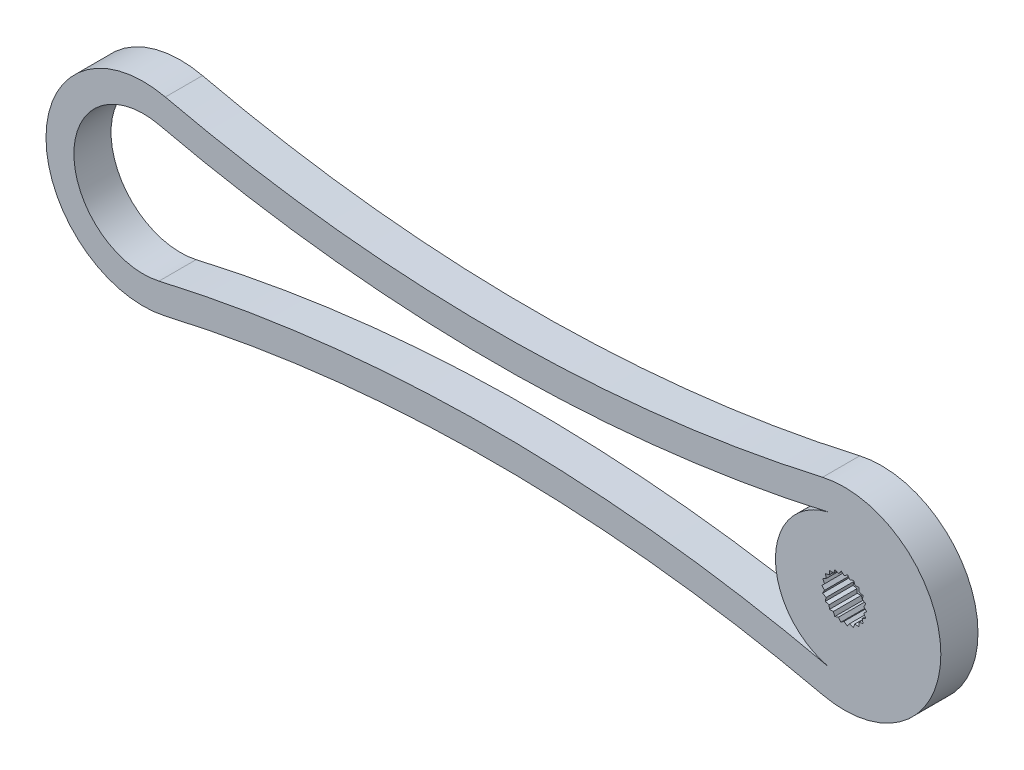
from build123d import *

# Parameters (mm, degrees)
SKIZZE1_R                       = 1
AUFSATZ_LINEAR_AUSTRAGEN1_DEPTH = 4
SCHNITT_LINEAR_AUSTRAGEN1_DEPTH = 6
SCHNITT_LINEAR_AUSTRAGEN2_DEPTH = 3


with BuildPart() as part:
    # Skizze1 → Aufsatz-Linear austragen1 (new body)
    with BuildSketch(Plane.XY):
        with BuildLine():
            ThreePointArc((-73.08156136, 10.209205546), (-85.925298124, 0), (-73.08156136, -10.209205546))
            ThreePointArc((-73.08156136, -10.209205546), (-37.708269243, -6.148967962), (-2.327018144, -10.139255556))
            ThreePointArc((-2.327018144, -10.139255556), (10.402860985, 0), (-2.327018144, 10.139255556))
            ThreePointArc((-2.327018144, 10.139255556), (-37.708269243, 6.148967962), (-73.08156136, 10.209205546))
        make_face()
        Circle(SKIZZE1_R, mode=Mode.SUBTRACT)
    extrude(amount=AUFSATZ_LINEAR_AUSTRAGEN1_DEPTH)

    # Skizze2 → Schnitt-Linear austragen1 (cut)
    with BuildSketch(Plane.XY.offset(4)):
        with BuildLine():
            ThreePointArc((-1.655947518, 7.215274671), (-7.402860985, 0), (-1.655947518, -7.215274671))
            ThreePointArc((-1.655947518, -7.215274671), (-37.711235128, -3.148969428), (-73.758412133, -7.286557255))
            ThreePointArc((-73.758412133, -7.286557255), (-82.925298124, 0), (-73.758412133, 7.286557255))
            ThreePointArc((-73.758412133, 7.286557255), (-37.711235128, 3.148969428), (-1.655947518, 7.215274671))
        make_face()
    extrude(amount=-SCHNITT_LINEAR_AUSTRAGEN1_DEPTH, mode=Mode.SUBTRACT)

    # Skizze6 → Schnitt-Linear austragen2 (cut)
    with BuildSketch(Plane.XY.offset(4)):
        Polygon((1.165582934, 1.788027089), (1.018080563, 2.19148446), (0.614623192, 2.043982089), (0.359428626, 2.389540381), (0.013870334, 2.134345816), (-0.32834208, 2.394009952), (-0.588006216, 2.051797538), (-0.989512463, 2.204531074), (-1.142245999, 1.803024827), (-1.570518432, 1.836454199), (-1.603947805, 1.408181766), (-2.024290337, 1.319598727), (-1.935707298, 0.899256194), (-2.314066279, 0.695837214), (-2.110647298, 0.317478234), (-2.416370332, 0.015703108), (-2.114595207, -0.290019926), (-2.322914432, -0.66570317), (-1.947231188, -0.874022395), (-2.04126982, -1.293178136), (-1.622114079, -1.387216768), (-1.594253667, -1.815887501), (-1.165582934, -1.788027089), (-1.018080563, -2.19148446), (-0.614623192, -2.043982089), (-0.359428626, -2.389540381), (-0.013870334, -2.134345816), (0.32834208, -2.394009952), (0.588006216, -2.051797538), (0.989512463, -2.204531074), (1.142245999, -1.803024827), (1.570518432, -1.836454199), (1.603947805, -1.408181766), (2.024290337, -1.319598727), (1.935707298, -0.899256194), (2.314066279, -0.695837214), (2.110647298, -0.317478234), (2.416370332, -0.015703108), (2.114595207, 0.290019926), (2.322914432, 0.66570317), (1.947231188, 0.874022395), (2.04126982, 1.293178136), (1.622114079, 1.387216768), (1.594253667, 1.815887501), align=None)
    extrude(amount=-SCHNITT_LINEAR_AUSTRAGEN2_DEPTH, mode=Mode.SUBTRACT)


solid = part.part
